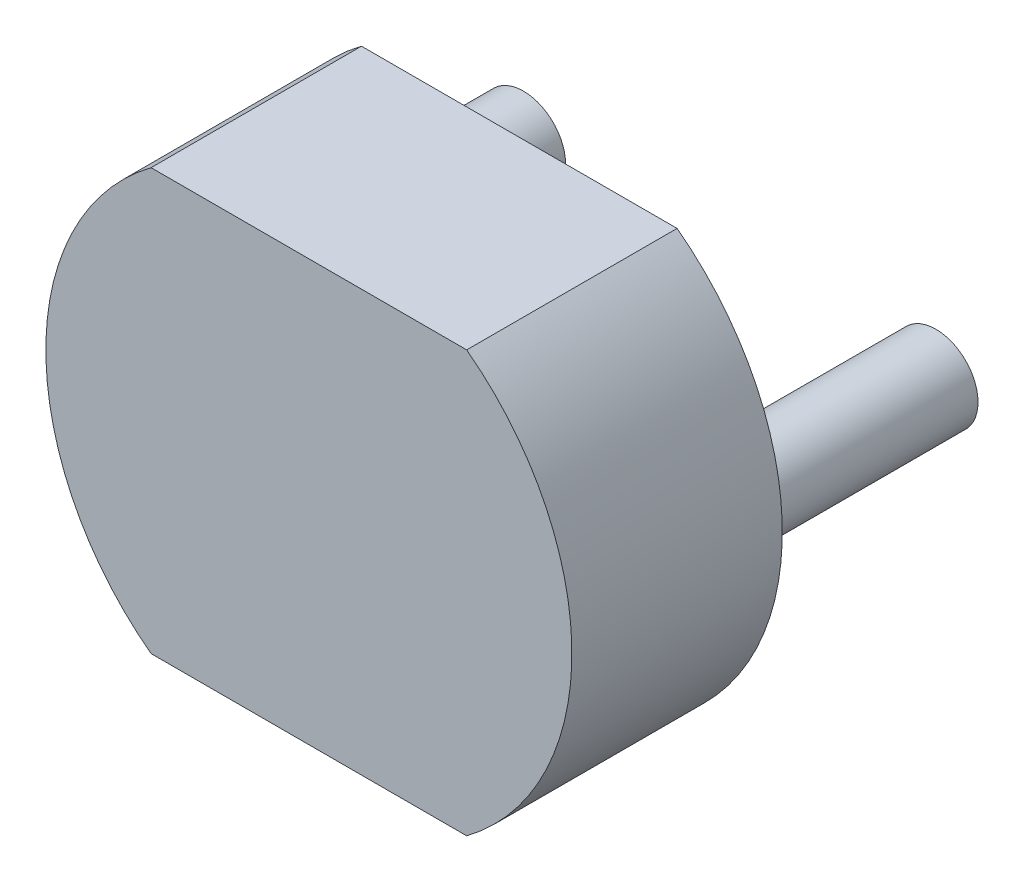
from build123d import *

# Parameters (mm, degrees)
SKETCH_1_W      = 3
SKETCH_1_H      = 4
EXTRUDE_1_DEPTH = 2
SKETCH_2_R      = 0.4
EXTRUDE_2_DEPTH = 2


with BuildPart() as part:
    # Эскиз1 → Бобышка-Вытянуть1 (new body)
    with BuildSketch(Plane.XY):
        with BuildLine():
            ThreePointArc((-1.5, 2), (-2.5, 0), (-1.5, -2))
            Line((-1.5, -2), (-1.5, 2))
        make_face()
        Rectangle(SKETCH_1_W, SKETCH_1_H)
        with BuildLine():
            Line((1.5, 2), (1.5, -2))
            ThreePointArc((1.5, -2), (2.236067977, -1.118033989), (2.5, 0))
            ThreePointArc((2.5, 0), (2.236067977, 1.118033989), (1.5, 2))
        make_face()
    extrude(amount=EXTRUDE_1_DEPTH)

    # Эскиз2 → Бобышка-Вытянуть2 (add)
    with BuildSketch(Plane(origin=(0, 0, 0), x_dir=(-1, 0, 0), z_dir=(0, 0, -1))):
        with Locations(Location((-1.96, 0, 0), (0, 0, 180))):
            Circle(SKETCH_2_R)
        with Locations(Location((1.96, 0, 0), (0, 0, 180))):
            Circle(SKETCH_2_R)
    extrude(amount=EXTRUDE_2_DEPTH)


solid = part.part
